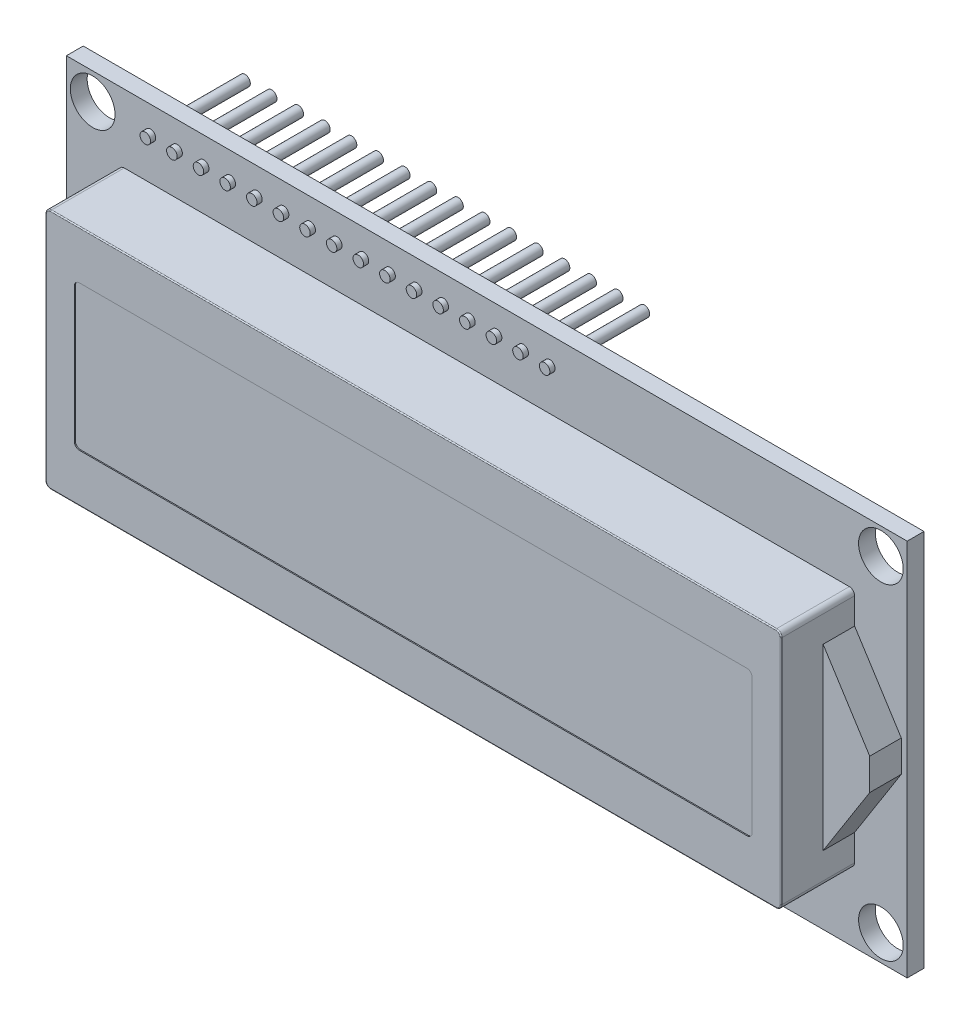
from build123d import *

# Parameters (mm, degrees)
CROQUIS1_W                   = 80
CROQUIS1_H                   = 36
CROQUIS1_R                   = 2.125
CROQUIS1_R_2                 = 0.5
SALIENTE_EXTRUIR1_DEPTH      = 1.6
CROQUIS2_W                   = 70
CROQUIS2_H                   = 23
SALIENTE_EXTRUIR2_DEPTH      = 7
SALIENTE_EXTRUIR3_DEPTH      = 3
SALIENTE_EXTRUIR4_DEPTH      = 0.5
SALIENTE_EXTRUIR4_DEPTH_BACK = 9
CROQUIS6_R                   = 0.5
CORTAR_EXTRUIR1_DEPTH        = 0.1
REDONDEO1_R                  = 0.5
FILLET2_R                    = 0.1


with BuildPart() as part:
    # Croquis1 → Saliente-Extruir1 (new body)
    with BuildSketch(Plane.XY):
        with Locations((40, 18)):
            Rectangle(CROQUIS1_W, CROQUIS1_H)
        with Locations((2.5, 33.46)):
            Circle(CROQUIS1_R, mode=Mode.SUBTRACT)
        with Locations(Location((77.5, 33.51, 0), (0, 0, 180))):
            Circle(CROQUIS1_R, mode=Mode.SUBTRACT)
        with Locations((77.5, 2.49)):
            Circle(CROQUIS1_R, mode=Mode.SUBTRACT)
        with Locations(Location((2.5, 2.49, 0), (0, 0, 180))):
            Circle(CROQUIS1_R, mode=Mode.SUBTRACT)
        with Locations((8, 33.46)):
            Circle(CROQUIS1_R_2, mode=Mode.SUBTRACT)
        with Locations((10.53333, 33.46)):
            Circle(CROQUIS1_R_2, mode=Mode.SUBTRACT)
        with Locations((13.06666, 33.46)):
            Circle(CROQUIS1_R_2, mode=Mode.SUBTRACT)
        with Locations((15.59999, 33.46)):
            Circle(CROQUIS1_R_2, mode=Mode.SUBTRACT)
        with Locations((18.13332, 33.46)):
            Circle(CROQUIS1_R_2, mode=Mode.SUBTRACT)
        with Locations((20.66665, 33.46)):
            Circle(CROQUIS1_R_2, mode=Mode.SUBTRACT)
        with Locations((23.19998, 33.46)):
            Circle(CROQUIS1_R_2, mode=Mode.SUBTRACT)
        with Locations((25.73331, 33.46)):
            Circle(CROQUIS1_R_2, mode=Mode.SUBTRACT)
        with Locations((28.26664, 33.46)):
            Circle(CROQUIS1_R_2, mode=Mode.SUBTRACT)
        with Locations((30.79997, 33.46)):
            Circle(CROQUIS1_R_2, mode=Mode.SUBTRACT)
        with Locations((33.3333, 33.46)):
            Circle(CROQUIS1_R_2, mode=Mode.SUBTRACT)
        with Locations((35.86663, 33.46)):
            Circle(CROQUIS1_R_2, mode=Mode.SUBTRACT)
        with Locations((38.39996, 33.46)):
            Circle(CROQUIS1_R_2, mode=Mode.SUBTRACT)
        with Locations((40.93329, 33.46)):
            Circle(CROQUIS1_R_2, mode=Mode.SUBTRACT)
        with Locations((43.46662, 33.46)):
            Circle(CROQUIS1_R_2, mode=Mode.SUBTRACT)
        with Locations((45.99995, 33.46)):
            Circle(CROQUIS1_R_2, mode=Mode.SUBTRACT)
    extrude(amount=SALIENTE_EXTRUIR1_DEPTH)

    # Croquis2 → Saliente-Extruir2 (add)
    with BuildSketch(Plane.XY.offset(1.6)):
        with Locations((40, 18)):
            Rectangle(CROQUIS2_W, CROQUIS2_H)
    extrude(amount=SALIENTE_EXTRUIR2_DEPTH)

    # Croquis3 → Saliente-Extruir3 (add)
    with BuildSketch(Plane.XY.offset(1.6)):
        Polygon((79.437795719, 19.5), (75, 26.5), (75, 9.5), (79.437795719, 16.5), align=None)
    extrude(amount=SALIENTE_EXTRUIR3_DEPTH)

    # Croquis6 → Saliente-Extruir4 (add, two sides: drawn at the far end of the back side and taken through both)
    with BuildSketch(Plane.XY.offset(1.6).offset(-SALIENTE_EXTRUIR4_DEPTH_BACK)):
        with Locations((8, 33.46)):
            Circle(CROQUIS6_R)
        with Locations((10.53333, 33.46)):
            Circle(CROQUIS6_R)
        with Locations((13.06666, 33.46)):
            Circle(CROQUIS6_R)
        with Locations((15.59999, 33.46)):
            Circle(CROQUIS6_R)
        with Locations((18.13332, 33.46)):
            Circle(CROQUIS6_R)
        with Locations((20.66665, 33.46)):
            Circle(CROQUIS6_R)
        with Locations((23.19998, 33.46)):
            Circle(CROQUIS6_R)
        with Locations((25.73331, 33.46)):
            Circle(CROQUIS6_R)
        with Locations((28.26664, 33.46)):
            Circle(CROQUIS6_R)
        with Locations((30.79997, 33.46)):
            Circle(CROQUIS6_R)
        with Locations((33.3333, 33.46)):
            Circle(CROQUIS6_R)
        with Locations((35.86663, 33.46)):
            Circle(CROQUIS6_R)
        with Locations((38.39996, 33.46)):
            Circle(CROQUIS6_R)
        with Locations((40.93329, 33.46)):
            Circle(CROQUIS6_R)
        with Locations((43.46662, 33.46)):
            Circle(CROQUIS6_R)
        with Locations((45.99995, 33.46)):
            Circle(CROQUIS6_R)
    extrude(amount=SALIENTE_EXTRUIR4_DEPTH + SALIENTE_EXTRUIR4_DEPTH_BACK)

    # Croquis7 → Cortar-Extruir1 (cut)
    with BuildSketch(Plane.XY.offset(8.6)):
        with BuildLine():
            Line((8.25, 24.9), (71.75, 24.9))
            ThreePointArc((71.75, 24.9), (72.103553391, 24.753553391), (72.25, 24.4))
            Line((72.25, 24.4), (72.25, 11.6))
            ThreePointArc((72.25, 11.6), (72.103553391, 11.246446609), (71.75, 11.1))
            Line((71.75, 11.1), (8.25, 11.1))
            ThreePointArc((8.25, 11.1), (7.896446609, 11.246446609), (7.75, 11.6))
            Line((7.75, 11.6), (7.75, 24.4))
            ThreePointArc((7.75, 24.4), (7.896446609, 24.753553391), (8.25, 24.9))
        make_face()
    extrude(amount=-CORTAR_EXTRUIR1_DEPTH, mode=Mode.SUBTRACT)

    # Redondeo1
    redondeo1_edges = [part.edges().sort_by_distance(p)[0] for p in [
        (5, 6.5, 5.1),
        (75, 6.5, 5.1),
        (75, 29.5, 5.1),
        (5, 29.5, 5.1),
    ]]
    fillet(redondeo1_edges, radius=REDONDEO1_R)

    # Fillet2
    fillet2_edges = [part.edges().sort_by_distance(p)[0] for p in [
        (40, 6.5, 8.6),
        (5, 18, 8.6),
        (75, 18, 8.6),
        (40, 29.5, 8.6),
        (74.853553391, 6.646446609, 8.6),
        (74.853553391, 29.353553391, 8.6),
        (5.146446609, 29.353553391, 8.6),
        (5.146446609, 6.646446609, 8.6),
    ]]
    fillet(fillet2_edges, radius=FILLET2_R)


solid = part.part
